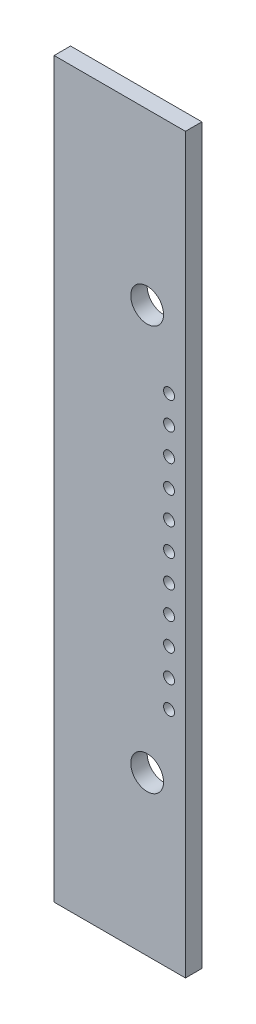
from build123d import *

# Parameters (mm, degrees)
SKETCH1_W           = 67
SKETCH1_H           = 12
BOSS_EXTRUDE1_DEPTH = 0.75
SKETCH2_R           = 0.5
CUT_EXTRUDE1_DEPTH  = 1.5
SKETCH3_R           = 1.5
CUT_EXTRUDE2_DEPTH  = 1.5


with BuildPart() as part:
    # Sketch1 → Boss-Extrude1 (new, symmetric)
    with BuildSketch(Plane(origin=(0, 0, 0), x_dir=(0, 1, 0), z_dir=(0, 0, 1))):
        Rectangle(SKETCH1_W, SKETCH1_H)
    extrude(amount=BOSS_EXTRUDE1_DEPTH, both=True)

    # Sketch2 → Cut-Extrude1 (cut)
    with BuildSketch(Plane.XY.offset(0.75)):
        with Locations((4.5, -13)):
            Circle(SKETCH2_R)
        with Locations((4.5, -10.5)):
            Circle(SKETCH2_R)
        with Locations((4.5, -8)):
            Circle(SKETCH2_R)
        with Locations((4.5, -5.5)):
            Circle(SKETCH2_R)
        with Locations((4.5, -3)):
            Circle(SKETCH2_R)
        with Locations((4.5, -0.5)):
            Circle(SKETCH2_R)
        with Locations((4.5, 2)):
            Circle(SKETCH2_R)
        with Locations((4.5, 4.5)):
            Circle(SKETCH2_R)
        with Locations((4.5, 7)):
            Circle(SKETCH2_R)
        with Locations((4.5, 9.5)):
            Circle(SKETCH2_R)
        with Locations((4.5, 12)):
            Circle(SKETCH2_R)
    extrude(amount=-CUT_EXTRUDE1_DEPTH, mode=Mode.SUBTRACT)

    # Sketch3 → Cut-Extrude2 (cut)
    with BuildSketch(Plane.XY.offset(0.75)):
        with Locations((2.5, -19)):
            Circle(SKETCH3_R)
        with Locations((2.5, 18)):
            Circle(SKETCH3_R)
    extrude(amount=-CUT_EXTRUDE2_DEPTH, mode=Mode.SUBTRACT)


solid = part.part
